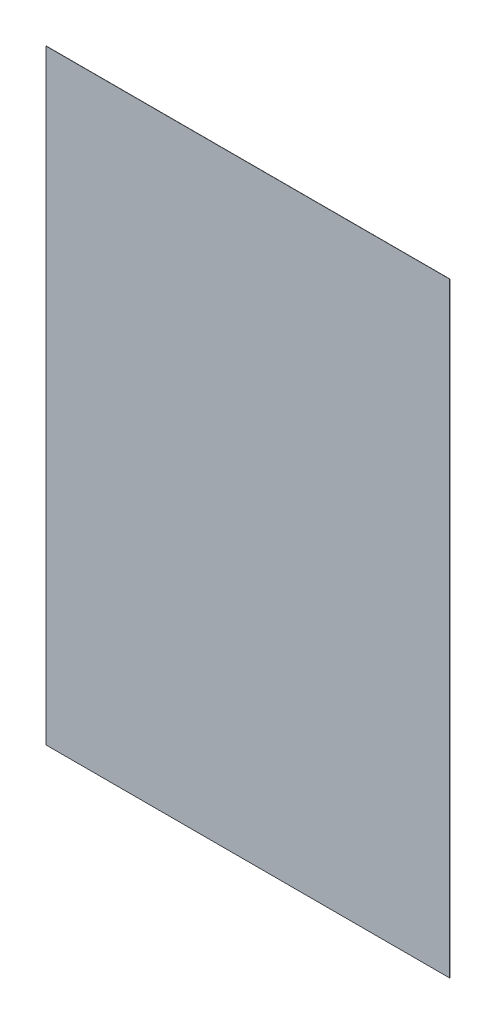
from build123d import *

# Parameters (mm, degrees)
SKETCH_MAIN_PROFILE_W   = 20
SKETCH_MAIN_PROFILE_H   = 30
FEATURE_THIN_WALL_DEPTH = 0.01


with BuildPart() as part:
    # sketch:main-profile → feature:thin-wall (new body)
    with BuildSketch(Plane.XY):
        with Locations((10, 15)):
            Rectangle(SKETCH_MAIN_PROFILE_W, SKETCH_MAIN_PROFILE_H)
    extrude(amount=FEATURE_THIN_WALL_DEPTH)


solid = part.part
